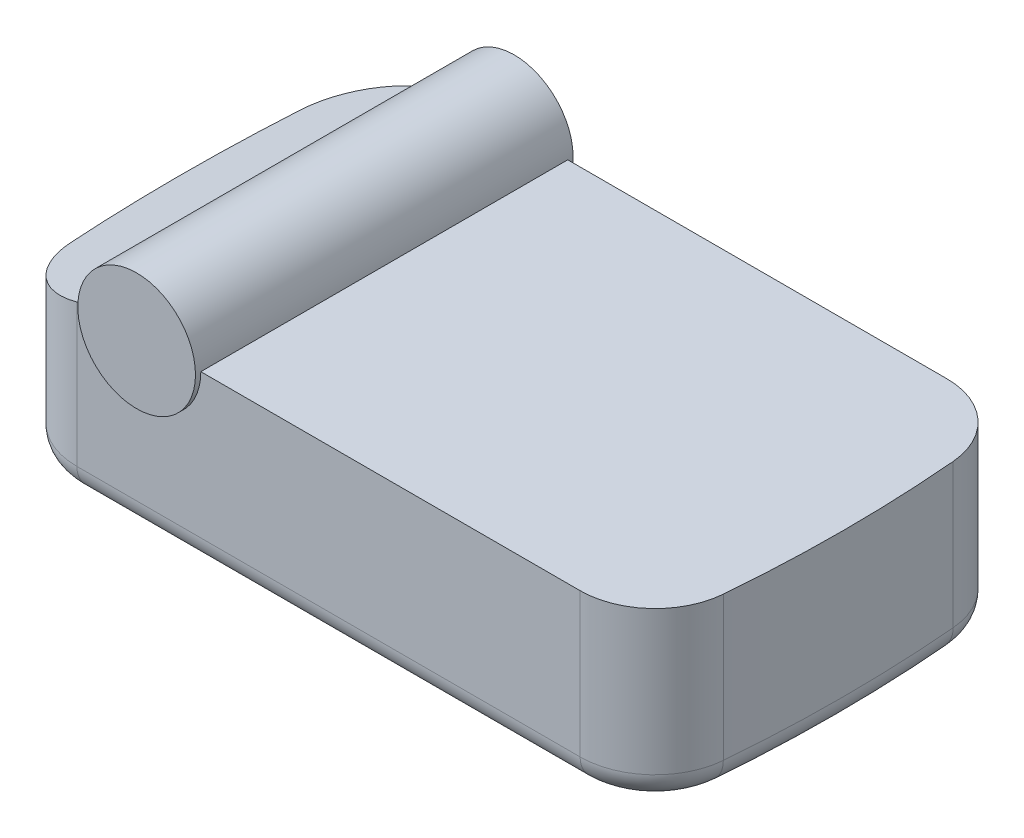
from build123d import *

# Parameters (mm, degrees)
BOSS_EXTRUDE1_DEPTH      = 16
FILLET1_R                = 2.54
BOSS_EXTRUDE2_DEPTH      = 0.5
BOSS_EXTRUDE2_DEPTH_BACK = 34.8
SKETCH3_R                = 5.5
CUT_EXTRUDE2_DEPTH       = 52.295150843


with BuildPart() as part:
    # Sketch1 → Boss-Extrude1 (new body)
    with BuildSketch(Plane(origin=(0, 0, 0), x_dir=(1, 0, 0), z_dir=(0, 1, 0))):
        with BuildLine():
            Line((-23.519969056, 17.15), (23.519969056, 17.15))
            ThreePointArc((23.519969056, 17.15), (28.255759205, 15.304831876), (30.494883917, 10.742083333))
            ThreePointArc((30.494883917, 10.742083333), (30.95, 0), (30.494883917, -10.742083333))
            ThreePointArc((30.494883917, -10.742083333), (28.255759205, -15.304831876), (23.519969056, -17.15))
            Line((23.519969056, -17.15), (-23.519969056, -17.15))
            ThreePointArc((-23.519969056, -17.15), (-28.255759205, -15.304831876), (-30.494883917, -10.742083333))
            ThreePointArc((-30.494883917, -10.742083333), (-30.95, 0), (-30.494883917, 10.742083333))
            ThreePointArc((-30.494883917, 10.742083333), (-28.255759205, 15.304831876), (-23.519969056, 17.15))
        make_face()
    extrude(amount=BOSS_EXTRUDE1_DEPTH)

    # Fillet1
    fillet1_edges = [part.edges().sort_by_distance(p)[0] for p in [
        (-30.95, 0, 0),
        (-28.255759205, 0, -15.304831876),
        (0, 0, -17.15),
        (28.255759205, 0, -15.304831876),
        (30.95, 0, 0),
        (28.255759205, 0, 15.304831876),
        (0, 0, 17.15),
        (-28.255759205, 0, 15.304831876),
    ]]
    fillet(fillet1_edges, radius=FILLET1_R)

    # Sketch3 → Boss-Extrude2 (add, two sides: drawn at the far end of the back side and taken through both)
    with BuildSketch(Plane.XY.offset(17.15).offset(-BOSS_EXTRUDE2_DEPTH_BACK)):
        with Locations((-17.438993952, 16)):
            Circle(SKETCH3_R)
    extrude(amount=BOSS_EXTRUDE2_DEPTH + BOSS_EXTRUDE2_DEPTH_BACK)

    # Sketch5 → Cut-Extrude2 (cut, through all)
    with BuildSketch(Plane.XY.offset(17.15)):
        Polygon((-22.938993952, 16), (-30.95, 13.853457399), (-30.95, 16), align=None)
    extrude(amount=-CUT_EXTRUDE2_DEPTH, mode=Mode.SUBTRACT)


solid = part.part
